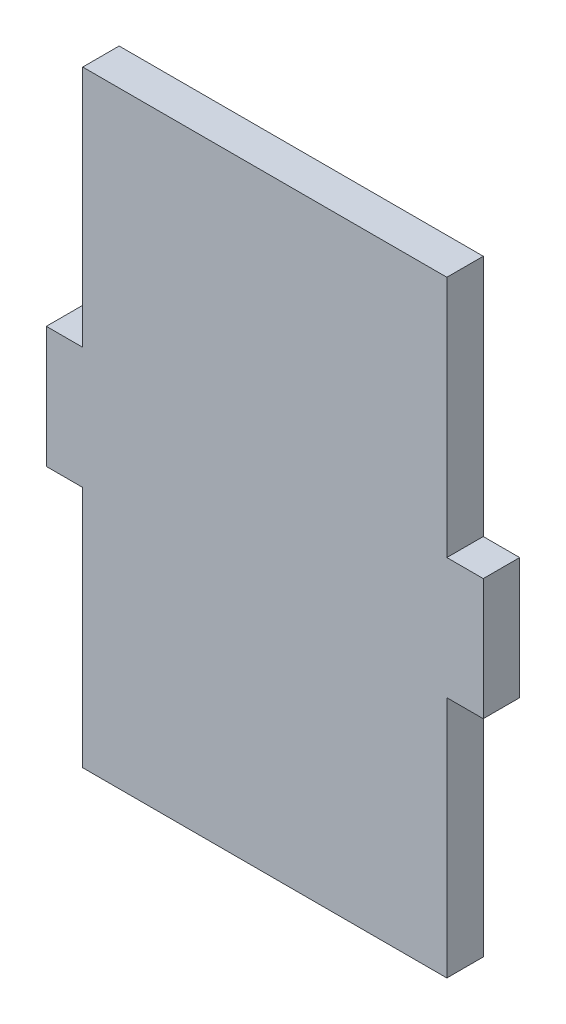
from build123d import *

# Parameters (mm, degrees)
BOSS_EXTRUDE1_DEPTH = 3


with BuildPart() as part:
    # Sketch1 → Boss-Extrude1 (new body)
    with BuildSketch(Plane.XY):
        Polygon((-15, -5), (-18, -5), (-18, 5), (-15, 5), (-15, 25), (15, 25), (15, 5), (18, 5), (18, -5), (15, -5), (15, -25), (-15, -25), align=None)
    extrude(amount=BOSS_EXTRUDE1_DEPTH)


solid = part.part
